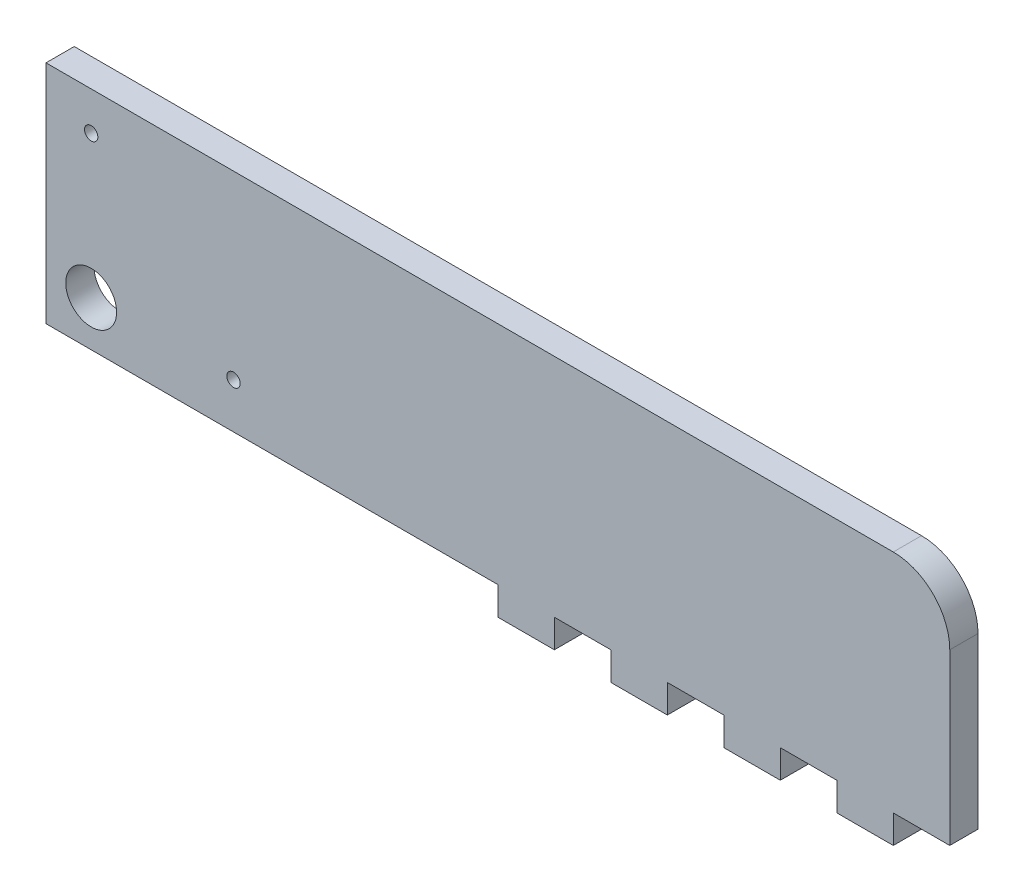
from build123d import *

# Parameters (mm, degrees)
SKETCH1_R           = 2.8575
SKETCH1_R_2         = 0.75
BOSS_EXTRUDE1_DEPTH = 3.175
FILLET1_R           = 6.35


with BuildPart() as part:
    # Sketch1 → Boss-Extrude1 (new body)
    with BuildSketch(Plane.XY):
        Polygon((95.25, 0), (95.25, -3.175), (88.9, -3.175), (88.9, 0), (82.55, 0), (82.55, -3.175), (76.2, -3.175), (76.2, 0), (69.85, 0), (69.85, -3.175), (63.5, -3.175), (63.5, 0), (57.15, 0), (57.15, -3.175), (50.8, -3.175), (50.8, 0), (44.45, 0), (0, 0), (0, 25.4), (101.6, 25.4), (101.6, 0), align=None)
        with Locations((5.08, 5.08)):
            Circle(SKETCH1_R, mode=Mode.SUBTRACT)
        with Locations((5.08, 21.08)):
            Circle(SKETCH1_R_2, mode=Mode.SUBTRACT)
        with Locations((21.08, 5.08)):
            Circle(SKETCH1_R_2, mode=Mode.SUBTRACT)
    extrude(amount=BOSS_EXTRUDE1_DEPTH)

    # Fillet1
    fillet1_edges = [part.edges().sort_by_distance(p)[0] for p in [
        (101.6, 25.4, 1.5875),
    ]]
    fillet(fillet1_edges, radius=FILLET1_R)


solid = part.part
